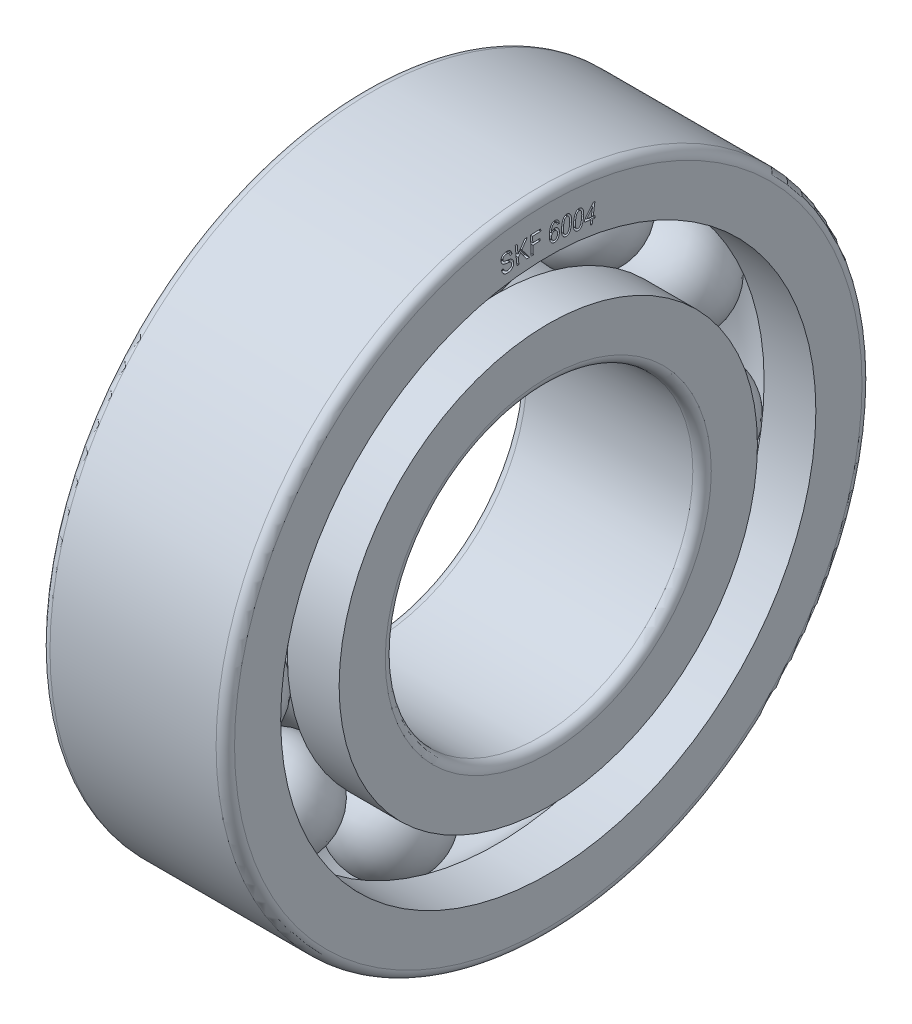
from build123d import *

# Parameters (mm, degrees)
FILLET1_R          = 0.6
FILLET2_R          = 0.6
CIRPATTERN2_COUNT  = 11
CUT_EXTRUDE1_DEPTH = 0.3


with BuildPart() as part:
    # Sketch1 → Revolve1 (revolve)
    with BuildSketch(Plane.XY, mode=Mode.PRIVATE) as revolve1_sk:
        with BuildLine():
            Line((0, 17.4), (3.363240625, 17.4))
            ThreePointArc((3.363240625, 17.4), (6, 18.75), (8.636759375, 17.4))
            Line((8.636759375, 17.4), (12, 17.4))
            Line((12, 17.4), (12, 21))
            Line((12, 21), (0, 21))
            Line((0, 21), (0, 17.4))
        make_face()
        with BuildLine():
            Line((0, 10), (12, 10))
            Line((12, 10), (12, 13.6))
            Line((12, 13.6), (8.636759375, 13.6))
            ThreePointArc((8.636759375, 13.6), (6, 12.25), (3.363240625, 13.6))
            Line((3.363240625, 13.6), (0, 13.6))
            Line((0, 13.6), (0, 10))
        make_face()
    revolve(revolve1_sk.sketch.rotate(Axis((0, 0, 0), (1, 0, 0)), 90), axis=Axis((0, 0, 0), (1, 0, 0)))

    # Fillet1
    fillet1_edges = [part.edges().sort_by_distance(p)[0] for p in [
        (0, 0, -21),
        (12, 0, -21),
    ]]
    fillet(fillet1_edges, radius=FILLET1_R)

    # Fillet2
    fillet2_edges = [part.edges().sort_by_distance(p)[0] for p in [
        (12, 0, -10),
        (0, 0, -10),
    ]]
    fillet(fillet2_edges, radius=FILLET2_R)

    # Sketch4 → Cut-Extrude1 (cut)
    # profile 1 of 7: a face of its own
    with BuildSketch(Plane(origin=(12, 0, 0), x_dir=(0, 0, -1), z_dir=(1, 0, 0))):
        with BuildLine():
            Line((-3.039624422, 18.133026292), (-2.919332214, 18.16370811))
            add(Edge.make_bspline(
                [(-2.919332214, 18.16370811), (-2.915245276, 18.148436543), (-2.907481405, 18.119425458), (-2.891879048, 18.079597174), (-2.874179966, 18.045416237), (-2.853658334, 18.016788511), (-2.830195265, 17.992796555), (-2.803456082, 17.972728951), (-2.773651229, 17.955598279), (-2.740748359, 17.94206812), (-2.705541651, 17.93221077), (-2.668527658, 17.92737008), (-2.630105838, 17.926060963), (-2.604297741, 17.929110967), (-2.591085461, 17.930672396)],
                knots=[0, 0, 0, 0, 1.264532598, 2.40220669, 3.416470379, 4.337864859, 5.21075391, 6.091729005, 7.005533806, 7.955060489, 8.932276733, 9.922728045, 10.936554691, 12, 12, 12, 12], degree=3))
            add(Edge.make_bspline(
                [(-2.591085461, 17.930672396), (-2.581719159, 17.932138856), (-2.563497873, 17.93499172), (-2.537356701, 17.941775347), (-2.512954322, 17.949537763), (-2.490710267, 17.959530762), (-2.470017795, 17.970389243), (-2.451290549, 17.983008457), (-2.434473784, 17.997319452), (-2.419774066, 18.013127738), (-2.406720304, 18.029905023), (-2.396089292, 18.047711247), (-2.387325595, 18.066171805), (-2.381136005, 18.085527095), (-2.376534679, 18.105549151), (-2.374829116, 18.12641038), (-2.374640397, 18.14794498), (-2.376393424, 18.162419574), (-2.377286759, 18.169795773)],
                knots=[0, 0, 0, 0, 1.257268176, 2.445900818, 3.580143169, 4.650824221, 5.677247529, 6.678031954, 7.640704742, 8.600843382, 9.53799014, 10.456063693, 11.34753004, 12.243345505, 13.147604037, 14.067192772, 15.01504872, 16, 16, 16, 16], degree=3))
            add(Edge.make_bspline(
                [(-2.377286759, 18.169795773), (-2.378769088, 18.17837031), (-2.381652256, 18.195048014), (-2.389576049, 18.218634838), (-2.400070855, 18.240060655), (-2.413342724, 18.259299777), (-2.429456543, 18.27623317), (-2.4480504, 18.291335581), (-2.469739794, 18.303570982), (-2.489916254, 18.31231489), (-2.50884396, 18.318269005), (-2.52671847, 18.323116409), (-2.548066487, 18.328196966), (-2.57292394, 18.33326395), (-2.601281586, 18.338320862), (-2.633108328, 18.34363394), (-2.66839646, 18.349300809), (-2.69310833, 18.35279267), (-2.706020526, 18.354617201)],
                knots=[0, 0, 0, 0, 1.01302786, 1.970366084, 2.888476181, 3.785980766, 4.682787019, 5.604739718, 6.566973651, 7.575663043, 8.162063231, 8.878132164, 9.734035586, 10.719248734, 11.834508281, 13.091192763, 14.48011957, 16, 16, 16, 16], degree=3))
            add(Edge.make_bspline(
                [(-2.706020526, 18.354617201), (-2.717639491, 18.356331708), (-2.740111749, 18.359647738), (-2.772471516, 18.365608679), (-2.802412672, 18.37150179), (-2.8298038, 18.37823847), (-2.854826376, 18.384834229), (-2.877220914, 18.392180534), (-2.897185226, 18.399702921), (-2.920295505, 18.410281711), (-2.946400547, 18.425479139), (-2.974561657, 18.447144193), (-3.000145262, 18.471847559), (-3.022510945, 18.499939578), (-3.041732707, 18.530986143), (-3.056652664, 18.565085423), (-3.06838093, 18.601633428), (-3.072878687, 18.627193126), (-3.07517637, 18.640250318)],
                knots=[0, 0, 0, 0, 1.105144369, 2.137461458, 3.096196716, 3.976207159, 4.791516329, 5.530668712, 6.193144397, 6.798124264, 7.920867413, 9.026961673, 10.134321185, 11.259244824, 12.397676278, 13.560247132, 14.75365025, 16, 16, 16, 16], degree=3))
            add(Edge.make_bspline(
                [(-3.07517637, 18.640250318), (-3.076624134, 18.652084202), (-3.079462899, 18.675288001), (-3.079733615, 18.70985311), (-3.077576049, 18.743237686), (-3.071590357, 18.775374829), (-3.062599571, 18.806247073), (-3.050271824, 18.835794037), (-3.035174787, 18.864329027), (-3.016634615, 18.891144423), (-2.995516862, 18.916358005), (-2.971567858, 18.938938664), (-2.945330947, 18.959212552), (-2.916402352, 18.976335375), (-2.88529565, 18.991444793), (-2.851505317, 19.003404994), (-2.815400289, 19.01335716), (-2.790241163, 19.017509035), (-2.777367928, 19.019633435)],
                knots=[0, 0, 0, 0, 1.052719901, 2.0641659, 3.049433825, 4.004690291, 4.946604833, 5.885674863, 6.829090248, 7.793992225, 8.761051183, 9.730103066, 10.697029017, 11.684800141, 12.695355614, 13.748148819, 14.847789484, 16, 16, 16, 16], degree=3))
            add(Edge.make_bspline(
                [(-2.777367928, 19.019633435), (-2.759619597, 19.021633272), (-2.725082514, 19.025524824), (-2.674014718, 19.024960629), (-2.625696245, 19.017758452), (-2.580127407, 19.005186275), (-2.537783128, 18.986913723), (-2.499113746, 18.963077922), (-2.464438891, 18.933749346), (-2.433890274, 18.89920021), (-2.407849624, 18.859775671), (-2.386297495, 18.815931032), (-2.369318874, 18.767789781), (-2.362351721, 18.733699484), (-2.358780266, 18.716224344)],
                knots=[0, 0, 0, 0, 1.105832551, 2.151877232, 3.153175187, 4.124347179, 5.072516648, 6.000523759, 6.928312861, 7.875842072, 8.847924924, 9.846415815, 10.89604407, 12, 12, 12, 12], degree=3))
            Line((-2.358780266, 18.716224344), (-2.481751045, 18.686760058))
            add(Edge.make_bspline(
                [(-2.481751045, 18.686760058), (-2.484033729, 18.696057685), (-2.488465847, 18.714110192), (-2.497418309, 18.739635474), (-2.507055119, 18.763273678), (-2.518223206, 18.784765601), (-2.530909637, 18.804077286), (-2.544904826, 18.821249167), (-2.559973769, 18.836482834), (-2.576484292, 18.849430296), (-2.594082489, 18.860628342), (-2.613236573, 18.869158149), (-2.633326569, 18.876509572), (-2.654873774, 18.881200508), (-2.6776055, 18.884141356), (-2.701636643, 18.885033631), (-2.726881181, 18.884111111), (-2.744019712, 18.881942448), (-2.752773772, 18.880834734)],
                knots=[0, 0, 0, 0, 1.222544752, 2.373723707, 3.452305791, 4.482118674, 5.462985475, 6.399192772, 7.308533306, 8.194508969, 9.07506577, 9.966004921, 10.868041873, 11.803961911, 12.7764592, 13.793661653, 14.87304121, 16, 16, 16, 16], degree=3))
            add(Edge.make_bspline(
                [(-2.752773772, 18.880834734), (-2.761646589, 18.879422237), (-2.778941175, 18.876669048), (-2.803726292, 18.870501378), (-2.826707573, 18.863278772), (-2.847776149, 18.854684832), (-2.867143577, 18.845065443), (-2.884476944, 18.833793798), (-2.900039997, 18.821281525), (-2.913634356, 18.807424897), (-2.925278596, 18.792567658), (-2.935154771, 18.777117639), (-2.943058371, 18.761058876), (-2.948515852, 18.744185415), (-2.952917639, 18.72690554), (-2.954684909, 18.708803983), (-2.954784348, 18.690109712), (-2.953238799, 18.677578496), (-2.952449097, 18.671175643)],
                knots=[0, 0, 0, 0, 1.319625429, 2.572168177, 3.749000994, 4.856397913, 5.912510491, 6.921507775, 7.888242175, 8.841268592, 9.767038402, 10.657085723, 11.531899524, 12.388058786, 13.258797979, 14.146524859, 15.052962811, 16, 16, 16, 16], degree=3))
            add(Edge.make_bspline(
                [(-2.952449097, 18.671175643), (-2.950402728, 18.659753064), (-2.946509222, 18.638019991), (-2.933479162, 18.608746151), (-2.916963552, 18.583310043), (-2.90160653, 18.57106562), (-2.894007539, 18.565006812)],
                knots=[0, 0, 0, 0, 1.113783284, 2.119130409, 3.069304527, 4, 4, 4, 4], degree=3))
            add(Edge.make_bspline(
                [(-2.894007539, 18.565006812), (-2.889532762, 18.562115513), (-2.87982888, 18.555845518), (-2.862409428, 18.548660358), (-2.842050617, 18.541323151), (-2.818346738, 18.534626947), (-2.791382887, 18.528250062), (-2.761030272, 18.52263289), (-2.727467074, 18.516856286), (-2.703924854, 18.513933099), (-2.691653643, 18.512409409)],
                knots=[0, 0, 0, 0, 0.60606943, 1.314306057, 2.139469367, 3.07346218, 4.119120925, 5.29662775, 6.590886829, 8, 8, 8, 8], degree=3))
            add(Edge.make_bspline(
                [(-2.691653643, 18.512409409), (-2.679553003, 18.5109157), (-2.656218936, 18.508035331), (-2.622632084, 18.503095295), (-2.591780168, 18.498263515), (-2.563660212, 18.493473431), (-2.538349521, 18.488323652), (-2.515694708, 18.483228403), (-2.495755451, 18.478256189), (-2.483522825, 18.474471469), (-2.477854941, 18.472717851)],
                knots=[0, 0, 0, 0, 1.343966753, 2.591616073, 3.741947588, 4.786350282, 5.735666851, 6.588730959, 7.346100482, 8, 8, 8, 8], degree=3))
            add(Edge.make_bspline(
                [(-2.477854941, 18.472717851), (-2.462501151, 18.466945271), (-2.432570656, 18.455692275), (-2.391475728, 18.432490863), (-2.3554095, 18.404854141), (-2.324271392, 18.372861045), (-2.298442442, 18.336365743), (-2.277905167, 18.295396443), (-2.262309285, 18.250023866), (-2.256709834, 18.217791415), (-2.253828967, 18.20120811)],
                knots=[0, 0, 0, 0, 1.055456006, 2.05749328, 3.026983156, 3.973614651, 4.922453036, 5.895236819, 6.917118342, 8, 8, 8, 8], degree=3))
            add(Edge.make_bspline(
                [(-2.253828967, 18.20120811), (-2.251922392, 18.184349322), (-2.248169689, 18.151166233), (-2.250289366, 18.101405832), (-2.258872466, 18.053211593), (-2.273507273, 18.006994576), (-2.293484563, 17.963558345), (-2.319431877, 17.924311507), (-2.349989146, 17.889061409), (-2.38601275, 17.858624935), (-2.427026528, 17.832956787), (-2.473034803, 17.812165249), (-2.524148439, 17.796554936), (-2.560235992, 17.790260653), (-2.578910136, 17.787003565)],
                knots=[0, 0, 0, 0, 1.029639213, 2.026634935, 3.013405293, 3.996050762, 4.96464819, 5.908470892, 6.845167081, 7.78985268, 8.762722072, 9.775762907, 10.8490291, 12, 12, 12, 12], degree=3))
            add(Edge.make_bspline(
                [(-2.578910136, 17.787003565), (-2.593740963, 17.78510304), (-2.622674008, 17.78139536), (-2.66555751, 17.780597385), (-2.706658124, 17.783079691), (-2.745980847, 17.789687356), (-2.783505133, 17.799974143), (-2.819284973, 17.81379611), (-2.8530584, 17.831823351), (-2.884962338, 17.853176952), (-2.914439585, 17.878015041), (-2.940999648, 17.906016414), (-2.965214331, 17.936502209), (-2.985716642, 17.970415864), (-3.003930571, 18.006825919), (-3.018934805, 18.04624939), (-3.031250654, 18.088507706), (-3.036789222, 18.117953136), (-3.039624422, 18.133026292)],
                knots=[0, 0, 0, 0, 1.105314199, 2.156326598, 3.167194957, 4.147373021, 5.100002156, 6.041056615, 6.978426218, 7.925970784, 8.876174862, 9.823186629, 10.776874788, 11.750021103, 12.748906995, 13.784786679, 14.866029285, 16, 16, 16, 16], degree=3))
        make_face()
    # profile 2 of 7: a face of its own
    with BuildSketch(Plane(origin=(12, 0, 0), x_dir=(0, 0, -1), z_dir=(1, 0, 0))):
        Polygon((-2.037845856, 17.88196447), (-2.150589363, 19.075633301), (-2.021287415, 19.087808626), (-1.965280921, 18.49584434), (-1.535004947, 19.133831353), (-1.359193259, 19.150389795), (-1.724696506, 18.628068366), (-1.228673778, 17.958425509), (-1.399615337, 17.942354081), (-1.805053648, 18.513620314), (-1.947504947, 18.307857327), (-1.908543908, 17.894139795), align=None)
    # profile 3 of 7: a face of its own
    with BuildSketch(Plane(origin=(12, 0, 0), x_dir=(0, 0, -1), z_dir=(1, 0, 0))):
        Polygon((-1.105901997, 17.963598474), (-1.158499399, 19.168468604), (-0.492022127, 19.197689383), (-0.485934464, 19.055481591), (-1.02164875, 19.031861461), (-1.005333815, 18.658809513), (-0.541940958, 18.679264058), (-0.535609789, 18.537056266), (-0.999002646, 18.516601721), (-0.97513901, 17.969199123), align=None)
    # profile 4 of 7: a face of its own
    with BuildSketch(Plane(origin=(12, 0, 0), x_dir=(0, 0, -1), z_dir=(1, 0, 0))):
        with BuildLine():
            Line((0.716594719, 18.894395585), (0.595571992, 18.885629351))
            add(Edge.make_bspline(
                [(0.595571992, 18.885629351), (0.593031753, 18.900069663), (0.588273186, 18.927120343), (0.577209386, 18.963810861), (0.564993113, 18.994692477), (0.55326046, 19.011205202), (0.547844719, 19.018827403)],
                knots=[0, 0, 0, 0, 1.230013879, 2.304154667, 3.217205259, 4, 4, 4, 4], degree=3))
            add(Edge.make_bspline(
                [(0.547844719, 19.018827403), (0.543873761, 19.023532841), (0.536160861, 19.032672342), (0.523321171, 19.044839954), (0.509690587, 19.054879212), (0.49570877, 19.063764001), (0.480768837, 19.070196192), (0.465285275, 19.075135493), (0.449117091, 19.078449638), (0.438039222, 19.078958842), (0.432422641, 19.079217013)],
                knots=[0, 0, 0, 0, 1.096061874, 2.128910771, 3.140809282, 4.107721185, 5.072036185, 6.02753453, 6.999941826, 8, 8, 8, 8], degree=3))
            add(Edge.make_bspline(
                [(0.432422641, 19.079217013), (0.423789341, 19.079026208), (0.406653554, 19.078647489), (0.381579921, 19.072853288), (0.357781054, 19.062865752), (0.335218909, 19.048866213), (0.314106528, 19.030487217), (0.294394813, 19.007981022), (0.275479806, 18.981670511), (0.264829095, 18.961901648), (0.259289524, 18.951619611)],
                knots=[0, 0, 0, 0, 0.908758196, 1.80374684, 2.693933722, 3.620298261, 4.591413717, 5.63419701, 6.769515738, 8, 8, 8, 8], degree=3))
            add(Edge.make_bspline(
                [(0.259289524, 18.951619611), (0.254552107, 18.94179736), (0.244679876, 18.921328922), (0.233196614, 18.887812292), (0.222482126, 18.851243332), (0.214320384, 18.81102314), (0.206786204, 18.767548036), (0.201765576, 18.72052319), (0.197680082, 18.670187252), (0.196557983, 18.635475424), (0.195977836, 18.617528702)],
                knots=[0, 0, 0, 0, 0.763249127, 1.590523083, 2.477739333, 3.43120334, 4.463150149, 5.567609129, 6.742404356, 8, 8, 8, 8], degree=3))
            add(Edge.make_bspline(
                [(0.195977836, 18.617528702), (0.203398187, 18.629900953), (0.217802365, 18.653917621), (0.243733202, 18.685858761), (0.271948784, 18.713178304), (0.302904828, 18.735246685), (0.335538054, 18.75221012), (0.369092232, 18.764663057), (0.403627622, 18.771769596), (0.42687194, 18.772188892), (0.438510303, 18.772398832)],
                knots=[0, 0, 0, 0, 1.142719545, 2.218215297, 3.251519733, 4.248072899, 5.221071513, 6.159682522, 7.078558321, 8, 8, 8, 8], degree=3))
            add(Edge.make_bspline(
                [(0.438510303, 18.772398832), (0.448114553, 18.771813295), (0.467230151, 18.770647886), (0.495265961, 18.764902799), (0.52236644, 18.756124581), (0.54835514, 18.743800465), (0.573323721, 18.728062255), (0.597216209, 18.708995348), (0.619888591, 18.686511253), (0.641792902, 18.661437612), (0.661587477, 18.633401973), (0.678783685, 18.602885993), (0.693173062, 18.570190725), (0.70455746, 18.535160193), (0.71327133, 18.498090435), (0.719387092, 18.458866868), (0.722587157, 18.417420472), (0.722328066, 18.389043196), (0.722195368, 18.374509221)],
                knots=[0, 0, 0, 0, 0.84929228, 1.690369237, 2.520427915, 3.360954329, 4.224539599, 5.12280571, 6.055951936, 7.042312903, 8.061096175, 9.082299844, 10.132333522, 11.211856799, 12.332109857, 13.49350224, 14.716248296, 16, 16, 16, 16], degree=3))
            add(Edge.make_bspline(
                [(0.722195368, 18.374509221), (0.721222032, 18.354826808), (0.719312726, 18.316217591), (0.709569848, 18.259915988), (0.694834612, 18.206450268), (0.677715076, 18.164506359), (0.661645614, 18.133129868), (0.649076445, 18.111192802), (0.635591465, 18.090908491), (0.621546613, 18.072116558), (0.606648093, 18.05503189), (0.591049956, 18.039506702), (0.57439367, 18.025999479), (0.551925304, 18.009731906), (0.521887635, 17.993690356), (0.484125714, 17.979495924), (0.44445419, 17.971470687), (0.417522076, 17.971008613), (0.403932381, 17.970775455)],
                knots=[0, 0, 0, 0, 1.650249831, 3.237146515, 4.777041636, 6.290369038, 7.023552042, 7.730614342, 8.407928028, 9.063685673, 9.69528872, 10.30618514, 10.905418875, 11.490587798, 12.629038412, 13.746070391, 14.86268804, 16, 16, 16, 16], degree=3))
            add(Edge.make_bspline(
                [(0.403932381, 17.970775455), (0.391723451, 17.971443871), (0.367676234, 17.972760411), (0.3326369, 17.979978832), (0.299382886, 17.991336756), (0.267709598, 18.006626223), (0.238173238, 18.026804602), (0.209859488, 18.050405634), (0.183881895, 18.078811468), (0.159252221, 18.111069554), (0.137126629, 18.148431574), (0.118537159, 18.191429128), (0.102993635, 18.239792573), (0.091148879, 18.293821336), (0.081559525, 18.35314333), (0.075782437, 18.418067994), (0.072791242, 18.488442943), (0.073413918, 18.537169112), (0.073737576, 18.562496234)],
                knots=[0, 0, 0, 0, 0.772340491, 1.521233992, 2.253246295, 2.990082958, 3.737427119, 4.509597052, 5.315814162, 6.165772485, 7.072417683, 8.053712906, 9.12172502, 10.279678526, 11.54791419, 12.91918599, 14.398639707, 16, 16, 16, 16], degree=3))
            add(Edge.make_bspline(
                [(0.073737576, 18.562496234), (0.074597775, 18.590596039), (0.076253233, 18.644674262), (0.083078564, 18.722561082), (0.09191388, 18.794159367), (0.104369722, 18.85945177), (0.119445588, 18.918450558), (0.13763558, 18.971137982), (0.158677948, 19.017531254), (0.182923024, 19.057675092), (0.209882913, 19.091965319), (0.237980083, 19.121884461), (0.267957676, 19.147011622), (0.299512609, 19.167533354), (0.333052825, 19.182920052), (0.368015794, 19.194023727), (0.40475879, 19.200279861), (0.42972089, 19.200576171), (0.442406407, 19.200726754)],
                knots=[0, 0, 0, 0, 1.640945424, 3.158008229, 4.562786684, 5.850904679, 7.035902211, 8.114941341, 9.100895236, 10.004616424, 10.845405525, 11.643148038, 12.396711886, 13.123610394, 13.833868216, 14.544268297, 15.260210099, 16, 16, 16, 16], degree=3))
            add(Edge.make_bspline(
                [(0.442406407, 19.200726754), (0.451591814, 19.200231684), (0.469722206, 19.199254503), (0.49625643, 19.195150041), (0.521605201, 19.188478855), (0.545754369, 19.179577585), (0.568531346, 19.167865738), (0.590340513, 19.154369856), (0.610639482, 19.137979888), (0.629886984, 19.119635773), (0.647336807, 19.098785855), (0.663466497, 19.07611452), (0.676855608, 19.050808125), (0.688953079, 19.023703531), (0.698828662, 18.994408376), (0.706897355, 18.963000028), (0.712973829, 18.929463435), (0.71536902, 18.906266316), (0.716594719, 18.894395585)],
                knots=[0, 0, 0, 0, 0.969032217, 1.912700607, 2.823541133, 3.727608317, 4.618959894, 5.518442509, 6.425539756, 7.363257533, 8.316146967, 9.286725924, 10.289600198, 11.32750501, 12.412257473, 13.54298472, 14.742664279, 16, 16, 16, 16], degree=3))
        make_face()
        with BuildLine():
            add(Edge.make_bspline(
                [(0.209370693, 18.385954026), (0.209303889, 18.375316836), (0.209173686, 18.354584662), (0.211456379, 18.324240356), (0.215439184, 18.29538268), (0.221867731, 18.268153509), (0.229863787, 18.242379523), (0.239824303, 18.218094684), (0.252050697, 18.195505373), (0.265903875, 18.17456136), (0.281041317, 18.155685827), (0.297310607, 18.139361067), (0.313743226, 18.124963033), (0.331313211, 18.113524665), (0.34930503, 18.104033849), (0.368218176, 18.097556124), (0.387669123, 18.093193984), (0.400906058, 18.092428119), (0.407584979, 18.092041689)],
                knots=[0, 0, 0, 0, 1.300098503, 2.533927329, 3.717064741, 4.858123573, 5.950408885, 7.013819719, 8.06169662, 9.085614536, 10.080653645, 11.013996544, 11.900971459, 12.745980416, 13.57153417, 14.381308871, 15.183261841, 16, 16, 16, 16], degree=3))
            add(Edge.make_bspline(
                [(0.407584979, 18.092041689), (0.413442821, 18.092114697), (0.425168085, 18.092260834), (0.442558197, 18.095563323), (0.459468029, 18.101233036), (0.475913309, 18.109197077), (0.492181724, 18.119158723), (0.507652507, 18.132009429), (0.522787332, 18.14693146), (0.537387838, 18.163959837), (0.551027954, 18.183083353), (0.562899065, 18.204360712), (0.573147115, 18.227347967), (0.581654631, 18.252045037), (0.588462756, 18.278508967), (0.593582136, 18.306740318), (0.596645869, 18.336868517), (0.59754451, 18.357538741), (0.598007056, 18.368178052)],
                knots=[0, 0, 0, 0, 0.757844782, 1.516929005, 2.281818928, 3.062664406, 3.879776599, 4.74698916, 5.661682611, 6.63125573, 7.649619784, 8.699690827, 9.782430465, 10.906564801, 12.079896741, 13.319639648, 14.620373466, 16, 16, 16, 16], degree=3))
            add(Edge.make_bspline(
                [(0.598007056, 18.368178052), (0.598055526, 18.378571003), (0.598149913, 18.398809688), (0.596132698, 18.428328569), (0.592659656, 18.45611762), (0.586984334, 18.482072443), (0.579707142, 18.506275234), (0.570738268, 18.528849684), (0.559787215, 18.549581405), (0.547074896, 18.568332817), (0.533157829, 18.585155144), (0.518440339, 18.600067724), (0.502590478, 18.612614935), (0.486121123, 18.623188199), (0.468636719, 18.631279006), (0.450384373, 18.637093412), (0.431384419, 18.641226053), (0.418321121, 18.641821949), (0.411724589, 18.642122858)],
                knots=[0, 0, 0, 0, 1.347936303, 2.624900326, 3.83571674, 4.977916628, 6.067243781, 7.111456952, 8.124241376, 9.102665197, 10.045124065, 10.953553045, 11.815312975, 12.662538342, 13.487011241, 14.306221923, 15.144698194, 16, 16, 16, 16], degree=3))
            add(Edge.make_bspline(
                [(0.411724589, 18.642122858), (0.405223896, 18.642013156), (0.392407202, 18.641796869), (0.373391319, 18.639143539), (0.355036925, 18.633901863), (0.337189785, 18.626617323), (0.320018623, 18.616944153), (0.303307485, 18.605189083), (0.287385195, 18.590997696), (0.272009462, 18.574993939), (0.257898084, 18.557018248), (0.245520662, 18.537217006), (0.234747689, 18.515985812), (0.225850316, 18.493086677), (0.219291756, 18.468446543), (0.213802671, 18.442388688), (0.210371721, 18.414693142), (0.209710291, 18.395703759), (0.209370693, 18.385954026)],
                knots=[0, 0, 0, 0, 0.858433291, 1.692477562, 2.527623972, 3.373916647, 4.233153213, 5.125667867, 6.067817897, 7.04618882, 8.054367591, 9.08074376, 10.12615575, 11.195490818, 12.319348832, 13.49069763, 14.71164706, 16, 16, 16, 16], degree=3))
        make_face(mode=Mode.SUBTRACT)
    # profile 5 of 7: a face of its own
    with BuildSketch(Plane(origin=(12, 0, 0), x_dir=(0, 0, -1), z_dir=(1, 0, 0))):
        with BuildLine():
            add(Edge.make_bspline(
                [(0.866515755, 18.573897161), (0.868353145, 18.598427756), (0.871912779, 18.645951641), (0.880219068, 18.714680304), (0.890619455, 18.778634324), (0.903135748, 18.837943758), (0.918114533, 18.892455273), (0.935418288, 18.942176061), (0.954783886, 18.987241411), (0.976649424, 19.027558908), (1.000717505, 19.063036229), (1.02682445, 19.093669286), (1.055370358, 19.119011175), (1.085935559, 19.13964555), (1.119081576, 19.154420485), (1.153965015, 19.164964453), (1.191141608, 19.169799023), (1.216426608, 19.169126833), (1.22934043, 19.168783525)],
                knots=[0, 0, 0, 0, 1.52071856, 2.94613533, 4.278527021, 5.525588744, 6.69195839, 7.771190325, 8.778062243, 9.721254017, 10.602338405, 11.424256959, 12.202744833, 12.955727969, 13.694581763, 14.437700874, 15.202086077, 16, 16, 16, 16], degree=3))
            add(Edge.make_bspline(
                [(1.22934043, 19.168783525), (1.240832162, 19.167705411), (1.263333477, 19.165594417), (1.295751383, 19.157355108), (1.3260253, 19.145429278), (1.353994865, 19.129320641), (1.38007051, 19.109754938), (1.40378962, 19.086081084), (1.425428448, 19.05857919), (1.437604882, 19.038090949), (1.443869651, 19.027549759)],
                knots=[0, 0, 0, 0, 1.028796572, 2.014428947, 2.973536956, 3.924154321, 4.886157715, 5.874767035, 6.906568589, 8, 8, 8, 8], degree=3))
            add(Edge.make_bspline(
                [(1.443869651, 19.027549759), (1.451004734, 19.013485249), (1.465824453, 18.984272964), (1.482571379, 18.935798484), (1.495738728, 18.881955239), (1.505983624, 18.822652835), (1.512287907, 18.757792312), (1.515332402, 18.687489274), (1.515094062, 18.611672076), (1.512287803, 18.559359589), (1.510833937, 18.532257551)],
                knots=[0, 0, 0, 0, 0.74747845, 1.552528537, 2.425750432, 3.375339444, 4.40488348, 5.51500864, 6.712576413, 8, 8, 8, 8], degree=3))
            add(Edge.make_bspline(
                [(1.510833937, 18.532257551), (1.508960329, 18.50789389), (1.505331999, 18.46071252), (1.497501626, 18.392243209), (1.48665407, 18.328601945), (1.474273919, 18.269409568), (1.45909136, 18.215155627), (1.442267987, 18.165260266), (1.422517017, 18.120311926), (1.400957595, 18.079825502), (1.377129246, 18.044268813), (1.350998204, 18.013721034), (1.322484836, 17.988321354), (1.291876106, 17.967884821), (1.258990133, 17.952462402), (1.223880557, 17.942555543), (1.186626453, 17.937528194), (1.161252018, 17.938229462), (1.148252768, 17.93858872)],
                knots=[0, 0, 0, 0, 1.512963131, 2.929923983, 4.265120412, 5.509122722, 6.672384125, 7.751572322, 8.766557949, 9.708756187, 10.588326867, 11.411467803, 12.191113467, 12.945216462, 13.68270726, 14.430351586, 15.195873605, 16, 16, 16, 16], degree=3))
            add(Edge.make_bspline(
                [(1.148252768, 17.93858872), (1.136749956, 17.939713722), (1.114018884, 17.941936875), (1.081266582, 17.951085978), (1.050161063, 17.963651996), (1.021246836, 17.980987571), (0.994165142, 18.002440727), (0.969152876, 18.028187639), (0.945836188, 18.057942364), (0.924503105, 18.09211112), (0.905469834, 18.131444063), (0.89038696, 18.176998087), (0.87841069, 18.228446725), (0.869538606, 18.285919522), (0.863868227, 18.349354409), (0.861280117, 18.418840676), (0.862104144, 18.494404145), (0.865007183, 18.54671414), (0.866515755, 18.573897161)],
                knots=[0, 0, 0, 0, 0.715415375, 1.413755134, 2.099798702, 2.790332276, 3.496194568, 4.236476679, 5.010744611, 5.836068172, 6.729752084, 7.713369963, 8.804746901, 10.002077378, 11.316226353, 12.751705683, 14.312015609, 16, 16, 16, 16], degree=3))
        make_face()
        with BuildLine():
            add(Edge.make_bspline(
                [(0.990704067, 18.565861447), (0.989332226, 18.542409894), (0.986703839, 18.497477726), (0.985372638, 18.432997265), (0.985511053, 18.374422698), (0.988526029, 18.321783429), (0.993063557, 18.274984784), (1.000148773, 18.234155511), (1.008671417, 18.199046609), (1.020390033, 18.169664898), (1.03385812, 18.145052463), (1.047944015, 18.123486595), (1.063532952, 18.105201148), (1.080258896, 18.089844849), (1.098129228, 18.077436711), (1.117418038, 18.068416631), (1.13781888, 18.062034517), (1.152022508, 18.060587332), (1.15921056, 18.059854953)],
                knots=[0, 0, 0, 0, 1.923491243, 3.685326678, 5.280597779, 6.718505791, 8.00158336, 9.128199556, 10.109982868, 10.954222516, 11.709614192, 12.404603065, 13.059938496, 13.671582329, 14.259696066, 14.833513498, 15.409674385, 16, 16, 16, 16], degree=3))
            add(Edge.make_bspline(
                [(1.15921056, 18.059854953), (1.166040817, 18.059709033), (1.179554574, 18.059420328), (1.19966977, 18.062997701), (1.21903905, 18.069913272), (1.237647684, 18.08008861), (1.255688805, 18.093216043), (1.273024214, 18.109672168), (1.28939195, 18.12955635), (1.305687857, 18.152551043), (1.320781383, 18.180470141), (1.33413855, 18.214185201), (1.346157405, 18.253898393), (1.357043422, 18.299512163), (1.366387267, 18.351147127), (1.374276761, 18.408846191), (1.381139283, 18.47250309), (1.384278758, 18.51706621), (1.385915106, 18.540293265)],
                knots=[0, 0, 0, 0, 0.563334146, 1.114564313, 1.676619788, 2.255699152, 2.860642716, 3.515282611, 4.224491241, 4.985365287, 5.840595533, 6.839299531, 7.976218781, 9.266016677, 10.711519647, 12.309505142, 14.076451419, 16, 16, 16, 16], degree=3))
            add(Edge.make_bspline(
                [(1.385915106, 18.540293265), (1.387286486, 18.56382598), (1.389909673, 18.608839523), (1.391249608, 18.673482438), (1.391105092, 18.732136731), (1.388119926, 18.78478155), (1.383503834, 18.831484131), (1.376565826, 18.872288661), (1.367641475, 18.907314219), (1.356000386, 18.936736451), (1.342516901, 18.961347934), (1.328422495, 18.982901401), (1.31283768, 19.001278687), (1.295857802, 19.016555077), (1.277752518, 19.028964351), (1.25815512, 19.038035579), (1.237405087, 19.044328888), (1.222970242, 19.045801823), (1.215704067, 19.046543265)],
                knots=[0, 0, 0, 0, 1.92482102, 3.681811227, 5.279323394, 6.713277013, 7.986233392, 9.109751278, 10.090515955, 10.932433858, 11.685748131, 12.378825713, 13.032358905, 13.647235008, 14.239211895, 14.817447069, 15.404729496, 16, 16, 16, 16], degree=3))
            add(Edge.make_bspline(
                [(1.215704067, 19.046543265), (1.208955804, 19.046682982), (1.195524729, 19.04696106), (1.175556923, 19.043436873), (1.15635722, 19.036475843), (1.137888954, 19.026254432), (1.12002913, 19.013002895), (1.102951564, 18.996411112), (1.086319183, 18.976817402), (1.070315662, 18.953606197), (1.055031638, 18.92575473), (1.042093533, 18.891896091), (1.029892747, 18.852302015), (1.019362817, 18.806624733), (1.010293824, 18.754984076), (1.002322607, 18.697311354), (0.995485581, 18.633650808), (0.992342364, 18.589088223), (0.990704067, 18.565861447)],
                knots=[0, 0, 0, 0, 0.557488701, 1.109570485, 1.666168434, 2.240240338, 2.850088598, 3.50087149, 4.206045116, 4.97360925, 5.830160775, 6.827901699, 7.96657742, 9.256813146, 10.703349267, 12.303803552, 14.073479654, 16, 16, 16, 16], degree=3))
        make_face(mode=Mode.SUBTRACT)
    # profile 6 of 7: a face of its own
    with BuildSketch(Plane(origin=(12, 0, 0), x_dir=(0, 0, -1), z_dir=(1, 0, 0))):
        with BuildLine():
            add(Edge.make_bspline(
                [(1.651230608, 18.517481917), (1.654027571, 18.541698113), (1.659458298, 18.588717515), (1.670745032, 18.656614162), (1.683791034, 18.719764122), (1.69873754, 18.778114111), (1.715991764, 18.831543902), (1.73522382, 18.880206757), (1.756229748, 18.924266149), (1.779662537, 18.963374133), (1.804821328, 18.997743436), (1.832367564, 19.026807602), (1.861662091, 19.050920269), (1.892924931, 19.070003595), (1.926190971, 19.083822356), (1.961417874, 19.092329835), (1.998520555, 19.095908609), (2.023636255, 19.094069922), (2.036457881, 19.093131267)],
                knots=[0, 0, 0, 0, 1.516081504, 2.943701215, 4.279447587, 5.526040287, 6.688372888, 7.769348929, 8.77870856, 9.720758068, 10.601270191, 11.42265157, 12.204866497, 12.954704342, 13.692600213, 14.435882571, 15.201514229, 16, 16, 16, 16], degree=3))
            add(Edge.make_bspline(
                [(2.036457881, 19.093131267), (2.047793993, 19.091542241), (2.070027706, 19.088425656), (2.101935384, 19.079091402), (2.131451463, 19.065787426), (2.158716376, 19.048832688), (2.183742059, 19.028244133), (2.206311623, 19.003770688), (2.22666175, 18.97562943), (2.23790866, 18.954798298), (2.243681907, 18.944105293)],
                knots=[0, 0, 0, 0, 1.027164073, 2.014594684, 2.973958543, 3.926818165, 4.890162805, 5.875464894, 6.909436917, 8, 8, 8, 8], degree=3))
            add(Edge.make_bspline(
                [(2.243681907, 18.944105293), (2.250189255, 18.929868732), (2.263728009, 18.900249095), (2.278025332, 18.85128417), (2.289591617, 18.797356871), (2.296833258, 18.737951865), (2.300634374, 18.673303563), (2.300689641, 18.603320692), (2.29730191, 18.527991432), (2.292296742, 18.476148721), (2.289704634, 18.449300099)],
                knots=[0, 0, 0, 0, 0.745983214, 1.552042688, 2.427048042, 3.375738758, 4.403870734, 5.515339775, 6.713228872, 8, 8, 8, 8], degree=3))
            add(Edge.make_bspline(
                [(2.289704634, 18.449300099), (2.286878369, 18.425169773), (2.281392765, 18.378334331), (2.270510283, 18.310628141), (2.257373653, 18.247749089), (2.242416583, 18.189566275), (2.225130996, 18.136153826), (2.206015943, 18.087361389), (2.184934347, 18.043256478), (2.161545995, 18.004112174), (2.136259651, 17.969852844), (2.10912983, 17.940406663), (2.079819281, 17.916311705), (2.048314418, 17.897544031), (2.015116614, 17.883417445), (1.979753879, 17.874952617), (1.942579103, 17.871354901), (1.917380803, 17.873195324), (1.904477362, 17.874137761)],
                knots=[0, 0, 0, 0, 1.511702702, 2.934119739, 4.265480072, 5.507705231, 6.670523476, 7.756647243, 8.766428603, 9.708871717, 10.589751734, 11.411693594, 12.194235345, 12.941780338, 13.686590193, 14.430183108, 15.196134661, 16, 16, 16, 16], degree=3))
            add(Edge.make_bspline(
                [(1.904477362, 17.874137761), (1.89304474, 17.875761549), (1.870563912, 17.878954527), (1.838430755, 17.889261755), (1.808194105, 17.903224654), (1.780187682, 17.921659495), (1.754100278, 17.944019518), (1.730383546, 17.970673219), (1.708736833, 18.001370319), (1.688730375, 18.0361165), (1.671828151, 18.076213761), (1.658309029, 18.121930118), (1.64858518, 18.173584761), (1.642167826, 18.231043818), (1.639074693, 18.294395663), (1.639924984, 18.363625972), (1.643377994, 18.438713409), (1.648545992, 18.490552894), (1.651230608, 18.517481917)],
                knots=[0, 0, 0, 0, 0.71877237, 1.413376465, 2.094786729, 2.789538267, 3.496474711, 4.231051198, 5.007535017, 5.834777247, 6.725801874, 7.713592323, 8.801280049, 9.998266981, 11.315581196, 12.752734007, 14.313144923, 16, 16, 16, 16], degree=3))
        make_face()
        with BuildLine():
            add(Edge.make_bspline(
                [(1.774201388, 18.504332566), (1.771871217, 18.481049445), (1.767418749, 18.436560287), (1.76321086, 18.372565276), (1.761485397, 18.314410767), (1.761752321, 18.26199977), (1.764559212, 18.215319755), (1.769658723, 18.174414772), (1.777325311, 18.139242121), (1.787334409, 18.10942586), (1.799532802, 18.084189095), (1.812959322, 18.062339764), (1.827611559, 18.043431082), (1.843449555, 18.027299845), (1.860964721, 18.014537581), (1.879656234, 18.004689843), (1.899674739, 17.997615282), (1.913679239, 17.995502883), (1.920792297, 17.994429969)],
                knots=[0, 0, 0, 0, 1.926225858, 3.680613312, 5.278316196, 6.715026387, 7.993820828, 9.125995388, 10.105165807, 10.952526763, 11.708665895, 12.407766447, 13.060048736, 13.674291823, 14.262353169, 14.836234871, 15.408909341, 16, 16, 16, 16], degree=3))
            add(Edge.make_bspline(
                [(1.920792297, 17.994429969), (1.927530785, 17.99407077), (1.94097395, 17.993354174), (1.961091958, 17.995802556), (1.980683684, 18.001773137), (1.999469295, 18.01129316), (2.017999285, 18.023561358), (2.035742662, 18.039377274), (2.053006174, 18.05829364), (2.070217747, 18.080452583), (2.086243511, 18.10762378), (2.100888079, 18.140525879), (2.114683527, 18.179362743), (2.127199453, 18.22430284), (2.13846414, 18.275309124), (2.148891775, 18.332240318), (2.158088437, 18.395283043), (2.163125188, 18.439382011), (2.165759829, 18.462449449)],
                knots=[0, 0, 0, 0, 0.55987827, 1.116947258, 1.673730454, 2.252774486, 2.860631115, 3.515312741, 4.221618564, 4.986381517, 5.842203269, 6.835065663, 7.97410929, 9.263523839, 10.708126803, 12.312542381, 14.071152122, 16, 16, 16, 16], degree=3))
            add(Edge.make_bspline(
                [(2.165759829, 18.462449449), (2.168102519, 18.485732014), (2.172595127, 18.530381307), (2.176642434, 18.594548522), (2.178772975, 18.652852119), (2.178521535, 18.705278209), (2.175374718, 18.751950156), (2.170181606, 18.792803106), (2.163067939, 18.828048414), (2.152563516, 18.857559457), (2.140389472, 18.882653474), (2.126989294, 18.904429617), (2.112360559, 18.923443944), (2.096267535, 18.939397775), (2.078719501, 18.952320616), (2.059741236, 18.962141225), (2.039376166, 18.969128525), (2.025142481, 18.971270092), (2.017951388, 18.972352047)],
                knots=[0, 0, 0, 0, 1.922346106, 3.686509394, 5.281203391, 6.7150198, 7.991674024, 9.121568188, 10.097331826, 10.938874256, 11.687484963, 12.385177405, 13.036145885, 13.653885207, 14.240762097, 14.819397425, 15.403540047, 16, 16, 16, 16], degree=3))
            add(Edge.make_bspline(
                [(2.017951388, 18.972352047), (2.011215133, 18.972712214), (1.997937472, 18.97342213), (1.977923455, 18.97101821), (1.958682167, 18.964608882), (1.939625773, 18.955691967), (1.921650323, 18.942789377), (1.903530812, 18.927537746), (1.886840724, 18.908125952), (1.869458527, 18.886125216), (1.853497568, 18.85889801), (1.838787608, 18.826060647), (1.825282664, 18.787160182), (1.813131419, 18.742165017), (1.801417828, 18.691348814), (1.791048681, 18.634380583), (1.78190913, 18.571413569), (1.776842483, 18.527318202), (1.774201388, 18.504332566)],
                knots=[0, 0, 0, 0, 0.560907216, 1.105589896, 1.665397493, 2.242547649, 2.849719919, 3.501170775, 4.209226029, 4.975394466, 5.832789049, 6.827476128, 7.966350975, 9.256314267, 10.705069385, 12.305789329, 14.074315169, 16, 16, 16, 16], degree=3))
        make_face(mode=Mode.SUBTRACT)
    # profile 7 of 7: a face of its own
    with BuildSketch(Plane(origin=(12, 0, 0), x_dir=(0, 0, -1), z_dir=(1, 0, 0))):
        Polygon((2.733900057, 17.787459676), (2.7767572, 18.073336299), (2.352568888, 18.136647987), (2.372536421, 18.270820065), (2.935036421, 18.977719416), (3.032926031, 18.963109026), (2.917260446, 18.189488897), (3.049971485, 18.169764871), (3.030003953, 18.035592793), (2.897292914, 18.055316819), (2.854435771, 17.769440195), align=None)
        Polygon((2.796724732, 18.207508377), (2.877081875, 18.745901234), (2.490393563, 18.253287598), align=None, mode=Mode.SUBTRACT)
    extrude(amount=-CUT_EXTRUDE1_DEPTH, mode=Mode.SUBTRACT)


with BuildPart() as body_2:
    # Sketch2 → Revolve2 (revolve)
    with BuildSketch(Plane.XY):
        with BuildLine():
            Line((6, 18.75), (6, 12.25))
            ThreePointArc((6, 12.25), (2.75, 15.5), (6, 18.75))
        make_face()
    revolve(axis=Axis((6, 18.75, 0), (0, -1, 0)))


with BuildPart() as cirpattern2_1:
    # CirPattern2: pattern copy
    add(body_2.part.rotate(Axis((0, 0, 0), (1, 0, 0)), 1 * 360 / CIRPATTERN2_COUNT))


with BuildPart() as cirpattern2_2:
    # CirPattern2: pattern copy
    add(body_2.part.rotate(Axis((0, 0, 0), (1, 0, 0)), 2 * 360 / CIRPATTERN2_COUNT))


with BuildPart() as cirpattern2_3:
    # CirPattern2: pattern copy
    add(body_2.part.rotate(Axis((0, 0, 0), (1, 0, 0)), 3 * 360 / CIRPATTERN2_COUNT))


with BuildPart() as cirpattern2_4:
    # CirPattern2: pattern copy
    add(body_2.part.rotate(Axis((0, 0, 0), (1, 0, 0)), 4 * 360 / CIRPATTERN2_COUNT))


with BuildPart() as cirpattern2_5:
    # CirPattern2: pattern copy
    add(body_2.part.rotate(Axis((0, 0, 0), (1, 0, 0)), 5 * 360 / CIRPATTERN2_COUNT))


with BuildPart() as cirpattern2_6:
    # CirPattern2: pattern copy
    add(body_2.part.rotate(Axis((0, 0, 0), (1, 0, 0)), 6 * 360 / CIRPATTERN2_COUNT))


with BuildPart() as cirpattern2_7:
    # CirPattern2: pattern copy
    add(body_2.part.rotate(Axis((0, 0, 0), (1, 0, 0)), 7 * 360 / CIRPATTERN2_COUNT))


with BuildPart() as cirpattern2_8:
    # CirPattern2: pattern copy
    add(body_2.part.rotate(Axis((0, 0, 0), (1, 0, 0)), 8 * 360 / CIRPATTERN2_COUNT))


with BuildPart() as cirpattern2_9:
    # CirPattern2: pattern copy
    add(body_2.part.rotate(Axis((0, 0, 0), (1, 0, 0)), 9 * 360 / CIRPATTERN2_COUNT))


with BuildPart() as cirpattern2_10:
    # CirPattern2: pattern copy
    add(body_2.part.rotate(Axis((0, 0, 0), (1, 0, 0)), 10 * 360 / CIRPATTERN2_COUNT))


solid = Compound([part.part, body_2.part, cirpattern2_1.part, cirpattern2_2.part, cirpattern2_3.part, cirpattern2_4.part, cirpattern2_5.part, cirpattern2_6.part, cirpattern2_7.part, cirpattern2_8.part, cirpattern2_9.part, cirpattern2_10.part])
